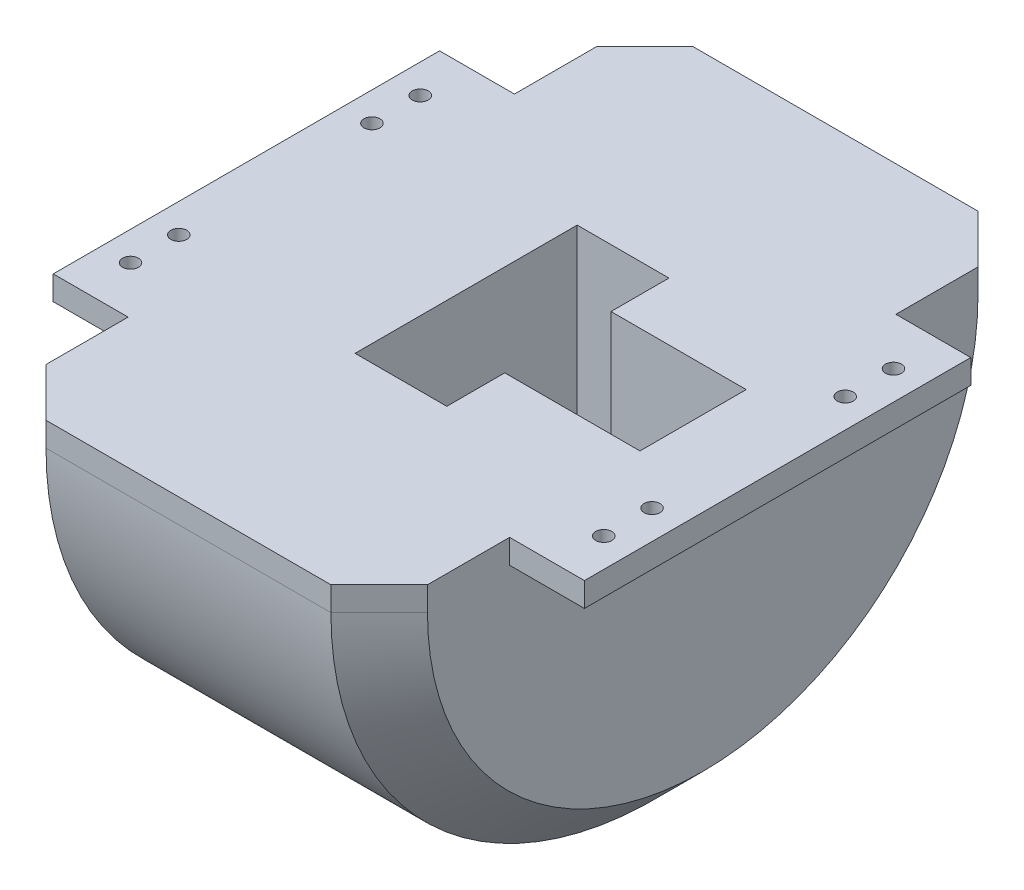
from build123d import *

# Parameters (mm, degrees)
SKETCH2_W           = 110
SKETCH2_H           = 80
SKETCH2_R           = 1.65
BOSS_EXTRUDE1_DEPTH = 5
SKETCH4_W           = 79
SKETCH4_H           = 27
BOSS_EXTRUDE2_DEPTH = 5
BOSS_EXTRUDE3_DEPTH = 79
SKETCH7_W           = 28
SKETCH7_H           = 22
CUT_EXTRUDE1_DEPTH  = 55.5
CHAMFER1_SIZE       = 10


with BuildPart() as part:
    # Sketch2 → Boss-Extrude1 (new body)
    with BuildSketch(Plane(origin=(0, 0, 0), x_dir=(1, 0, 0), z_dir=(0, 1, 0))):
        Rectangle(SKETCH2_W, SKETCH2_H)
        with Locations(Location((-49, 30, 0), (0, 0, 270))):
            Circle(SKETCH2_R, mode=Mode.SUBTRACT)
        with Locations(Location((-49, 20, 0), (0, 0, 270))):
            Circle(SKETCH2_R, mode=Mode.SUBTRACT)
        with Locations(Location((49, 20, 0), (0, 0, 90))):
            Circle(SKETCH2_R, mode=Mode.SUBTRACT)
        with Locations(Location((49, 30, 0), (0, 0, 90))):
            Circle(SKETCH2_R, mode=Mode.SUBTRACT)
        with Locations(Location((49, -30, 0), (0, 0, 270))):
            Circle(SKETCH2_R, mode=Mode.SUBTRACT)
        with Locations(Location((49, -20, 0), (0, 0, 270))):
            Circle(SKETCH2_R, mode=Mode.SUBTRACT)
        with Locations(Location((-49, -30, 0), (0, 0, 90))):
            Circle(SKETCH2_R, mode=Mode.SUBTRACT)
        with Locations(Location((-49, -20, 0), (0, 0, 90))):
            Circle(SKETCH2_R, mode=Mode.SUBTRACT)
        Polygon((9.5, -11), (9.5, -23), (-9.5, -23), (-9.5, 23), (9.5, 23), (9.5, 11), (37.5, 11), (37.5, -11), align=None, mode=Mode.SUBTRACT)
    extrude(amount=BOSS_EXTRUDE1_DEPTH)

    # Sketch4 → Boss-Extrude2 (add)
    with BuildSketch(Plane(origin=(0, 5, 0), x_dir=(1, 0, 0), z_dir=(0, 1, 0))):
        with Locations((0, 53.5)):
            Rectangle(SKETCH4_W, SKETCH4_H)
        with Locations((0, -53.5)):
            Rectangle(SKETCH4_W, SKETCH4_H)
    extrude(amount=-BOSS_EXTRUDE2_DEPTH)

    # Sketch6 → Boss-Extrude3 (add)
    with BuildSketch(Plane.ZY.offset(39.5)):
        with BuildLine():
            Line((-67, 0), (67, 0))
            ThreePointArc((67, 0), (0, -67), (-67, 0))
        make_face()
    extrude(amount=-BOSS_EXTRUDE3_DEPTH)

    # Sketch7 → Cut-Extrude1 (cut)
    with BuildSketch(Plane(origin=(0, 0, 0), x_dir=(1, 0, 0), z_dir=(0, 1, 0))):
        with Locations((23.5, 0)):
            Rectangle(SKETCH7_W, SKETCH7_H)
        Polygon((-9.5, 23), (-9.5, -23), (9.5, -23), (9.5, -11), (9.5, 11), (9.5, 23), align=None)
    extrude(amount=-CUT_EXTRUDE1_DEPTH, mode=Mode.SUBTRACT)

    # Chamfer1
    chamfer1_edges = [part.edges().sort_by_distance(p)[0] for p in [
        (39.5, -67, 0),
        (-39.5, -67, 0),
        (-39.5, 2.5, -67),
        (39.5, 2.5, -67),
        (39.5, 2.5, 67),
        (-39.5, 2.5, 67),
    ]]
    chamfer(chamfer1_edges, length=CHAMFER1_SIZE)


solid = part.part
